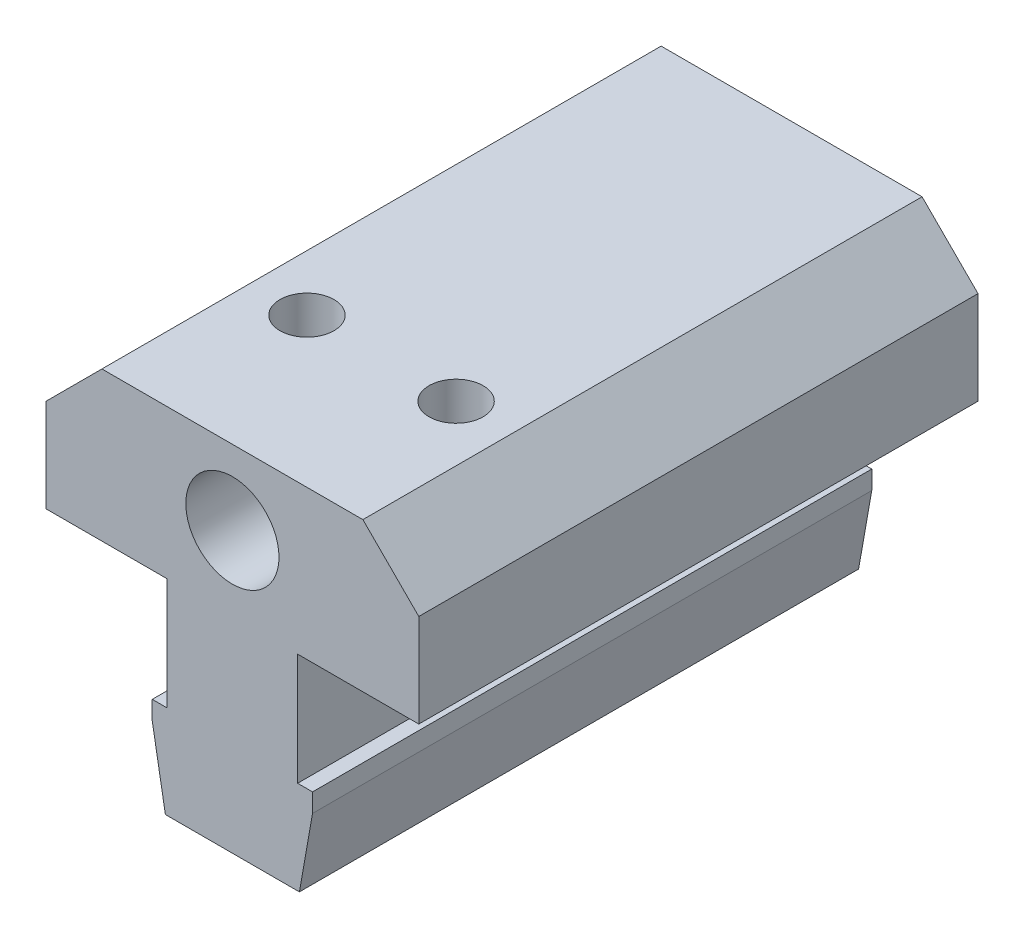
from build123d import *
from OCP.BRepFilletAPI import BRepFilletAPI_MakeChamfer

# Parameters (mm, degrees)
BOSS_EXTRUDE1_DEPTH = 30
SKETCH2_R           = 1.45
CUT_EXTRUDE1_DEPTH  = 8
SKETCH3_R           = 2.5
CUT_EXTRUDE2_DEPTH  = 41.755367745
CHAMFER1_SIZE       = 3
CHAMFER2_SIZE       = 4
CHAMFER2_SIZE2      = 0.705307923


with BuildPart() as part:
    # Sketch1 → Boss-Extrude1 (new body)
    with BuildSketch(Plane.XY):
        Polygon((0, 0), (20, 0), (20, -8), (13.5, -8), (13.5, -14), (14.3, -14), (14.3, -19), (5.7, -19), (5.7, -14), (6.5, -14), (6.5, -8), (0, -8), align=None)
    extrude(amount=BOSS_EXTRUDE1_DEPTH)

    # Sketch2 → Cut-Extrude1 (cut)
    with BuildSketch(Plane(origin=(0, 0, 0), x_dir=(1, 0, 0), z_dir=(0, 1, 0))):
        with Locations(Location((14, -22, 0), (0, 0, 270))):
            Circle(SKETCH2_R)
        with Locations(Location((6, -22, 0), (0, 0, 270))):
            Circle(SKETCH2_R)
    extrude(amount=-CUT_EXTRUDE1_DEPTH, mode=Mode.SUBTRACT)

    # Sketch3 → Cut-Extrude2 (cut, through all)
    with BuildSketch(Plane.XY.offset(30)):
        with Locations((10, -4)):
            Circle(SKETCH3_R)
    extrude(amount=-CUT_EXTRUDE2_DEPTH, mode=Mode.SUBTRACT)

    # Chamfer1
    chamfer1_edges = [part.edges().sort_by_distance(p)[0] for p in [
        (0, 0, 15),
        (20, 0, 15),
    ]]
    chamfer(chamfer1_edges, length=CHAMFER1_SIZE)

    # Chamfer2: one chamfer whose edges measure the first distance from different faces: ONE call of the kernel's chamfer builder (chamfer() names one face for all edges)
    chamfer2_edges_1 = [part.edges().sort_by_distance(p)[0] for p in [
        (14.3, -19, 15),
    ]]
    chamfer2_side_1 = [part.faces().sort_by_distance(p)[0] for p in [
        (14.3, -16.5, 15),
    ]]
    chamfer2_edges_2 = [part.edges().sort_by_distance(p)[0] for p in [
        (5.7, -19, 15),
    ]]
    chamfer2_side_2 = [part.faces().sort_by_distance(p)[0] for p in [
        (5.7, -16.5, 15),
    ]]
    chamfer2 = BRepFilletAPI_MakeChamfer(part.part.solid().wrapped)
    for e in chamfer2_edges_1:
        chamfer2.Add(CHAMFER2_SIZE, CHAMFER2_SIZE2, e.wrapped, chamfer2_side_1[0].wrapped)  # the first distance lies on this face
    for e in chamfer2_edges_2:
        chamfer2.Add(CHAMFER2_SIZE, CHAMFER2_SIZE2, e.wrapped, chamfer2_side_2[0].wrapped)  # the first distance lies on this face
    add(Compound.cast(chamfer2.Shape()), mode=Mode.REPLACE)


solid = part.part
